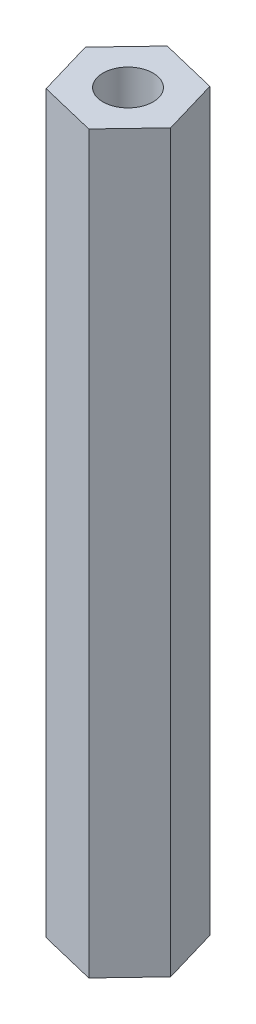
from build123d import *

# Parameters (mm, degrees)
SKETCH1_R           = 1.5
BOSS_EXTRUDE1_DEPTH = 22


with BuildPart() as part:
    # Sketch1 → Boss-Extrude1 (new, symmetric)
    with BuildSketch(Plane(origin=(0, 0, 0), x_dir=(1, 0, 0), z_dir=(0, 1, 0))):
        Polygon((0.977287067, -3.32338833), (3.366782253, -0.815338738), (2.389495187, 2.508049591), (-0.977287067, 3.32338833), (-3.366782253, 0.815338738), (-2.389495187, -2.508049591), align=None)
        with Locations(Location((0, 0, 0), (0, 0, 270))):
            Circle(SKETCH1_R, mode=Mode.SUBTRACT)
    extrude(amount=BOSS_EXTRUDE1_DEPTH, both=True)


solid = part.part
